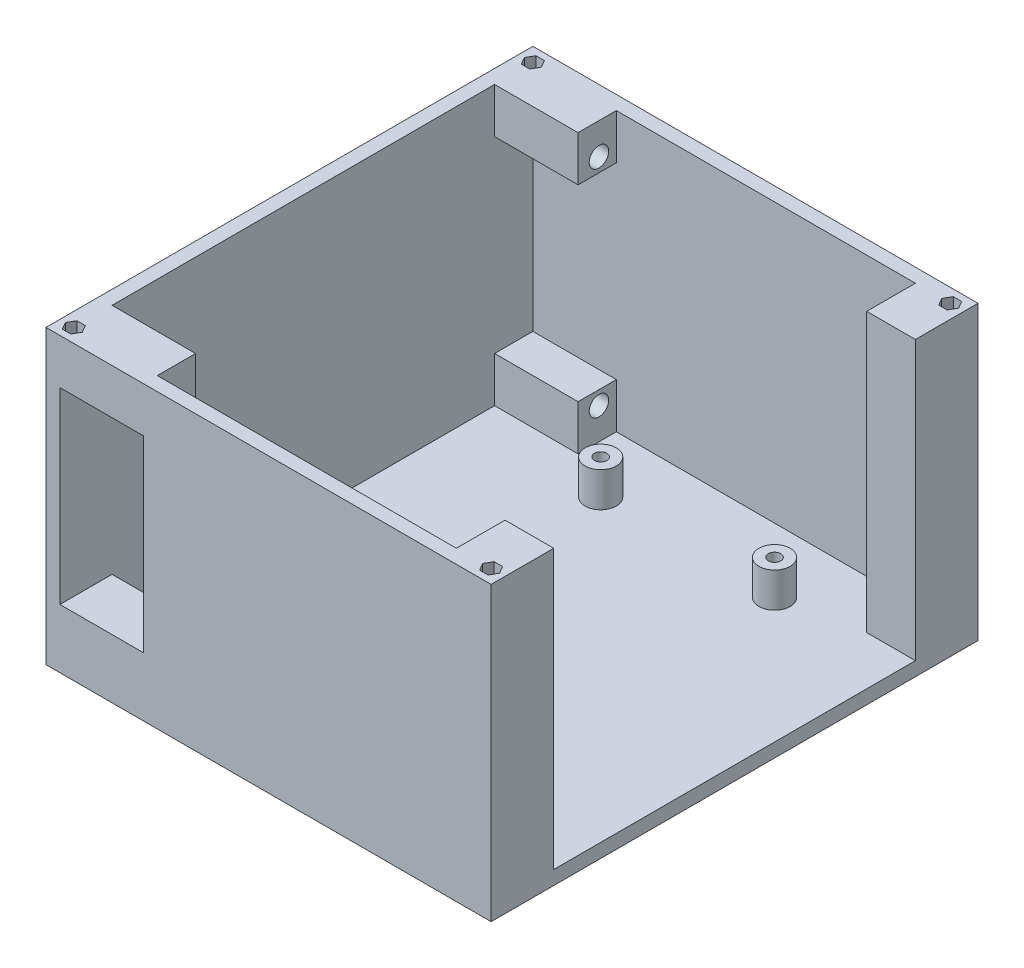
from build123d import *

# Parameters (mm, degrees)
SKETCH1_W           = 64
SKETCH1_H           = 70
BOSS_EXTRUDE1_DEPTH = 2
SKETCH2_W           = 64
SKETCH2_H           = 70
BOSS_EXTRUDE2_DEPTH = 40
SKETCH3_R           = 2.25
SKETCH3_R_2         = 0.9
BOSS_EXTRUDE3_DEPTH = 5
SKETCH4_W           = 52
SKETCH4_H           = 40
CUT_EXTRUDE1_DEPTH  = 2
SKETCH5_R           = 1
CUT_EXTRUDE4_DEPTH  = 4
CUT_EXTRUDE5_DEPTH  = 2.3
SKETCH7_R           = 1.4
CUT_EXTRUDE6_DEPTH  = 12
CUT_EXTRUDE7_REACH  = 105.73
SKETCH8_W           = 12
SKETCH8_H           = 27


with BuildPart() as part:
    # Sketch1 → Boss-Extrude1 (new body)
    with BuildSketch(Plane(origin=(0, 0, 0), x_dir=(1, 0, 0), z_dir=(0, 1, 0))):
        with Locations((32, -35)):
            Rectangle(SKETCH1_W, SKETCH1_H)
    extrude(amount=BOSS_EXTRUDE1_DEPTH)

    # Sketch2 → Boss-Extrude2 (add)
    with BuildSketch(Plane(origin=(0, 2, 0), x_dir=(1, 0, 0), z_dir=(0, 1, 0))):
        with Locations((32, -35)):
            Rectangle(SKETCH2_W, SKETCH2_H)
        Polygon((14, -2), (57, -2), (57, -9), (62, -9), (62, -61), (57, -61), (57, -68), (14, -68), (14, -62.5), (2, -62.5), (2, -7.5), (14, -7.5), align=None, mode=Mode.SUBTRACT)
    extrude(amount=BOSS_EXTRUDE2_DEPTH)

    # Sketch3 → Boss-Extrude3 (add)
    # profile 1 of 4: a face of its own
    with BuildSketch(Plane(origin=(0, 2, 0), x_dir=(1, 0, 0), z_dir=(0, 1, 0))):
        with Locations(Location((21, -58.75, 0), (0, 0, 270))):
            Circle(SKETCH3_R)
        with Locations(Location((21, -58.75, 0), (0, 0, 270))):
            Circle(SKETCH3_R_2, mode=Mode.SUBTRACT)
    # profile 2 of 4: a face of its own
    with BuildSketch(Plane(origin=(0, 2, 0), x_dir=(1, 0, 0), z_dir=(0, 1, 0))):
        with Locations(Location((46, -58.75, 0), (0, 0, 270))):
            Circle(SKETCH3_R)
        with Locations(Location((46, -58.75, 0), (0, 0, 270))):
            Circle(SKETCH3_R_2, mode=Mode.SUBTRACT)
    # profile 3 of 4: a face of its own
    with BuildSketch(Plane(origin=(0, 2, 0), x_dir=(1, 0, 0), z_dir=(0, 1, 0))):
        with Locations(Location((21, -11.25, 0), (0, 0, 270))):
            Circle(SKETCH3_R)
        with Locations(Location((21, -11.25, 0), (0, 0, 270))):
            Circle(SKETCH3_R_2, mode=Mode.SUBTRACT)
    # profile 4 of 4: a face of its own
    with BuildSketch(Plane(origin=(0, 2, 0), x_dir=(1, 0, 0), z_dir=(0, 1, 0))):
        with Locations(Location((46, -11.25, 0), (0, 0, 270))):
            Circle(SKETCH3_R)
        with Locations(Location((46, -11.25, 0), (0, 0, 270))):
            Circle(SKETCH3_R_2, mode=Mode.SUBTRACT)
    extrude(amount=BOSS_EXTRUDE3_DEPTH)

    # Sketch4 → Cut-Extrude1 (cut)
    with BuildSketch(Plane(origin=(64, 0, 0), x_dir=(0, 0, -1), z_dir=(1, 0, 0))):
        with Locations((-35, 22)):
            Rectangle(SKETCH4_W, SKETCH4_H)
    extrude(amount=-CUT_EXTRUDE1_DEPTH, mode=Mode.SUBTRACT)

    # Sketch5 → Cut-Extrude4 (cut)
    with BuildSketch(Plane.ZY.offset(-57)):
        with Locations((7, 40)):
            Circle(SKETCH5_R)
        with Locations((7, 4)):
            Circle(SKETCH5_R)
        with Locations((63, 4)):
            Circle(SKETCH5_R)
        with Locations((63, 40)):
            Circle(SKETCH5_R)
    extrude(amount=-CUT_EXTRUDE4_DEPTH, mode=Mode.SUBTRACT)

    # Sketch6 → Cut-Extrude5 (cut)
    with BuildSketch(Plane(origin=(0, 42, 0), x_dir=(1, 0, 0), z_dir=(0, 1, 0))):
        Polygon((3.212435565, -2), (2.606217783, -0.95), (1.393782217, -0.95), (0.787564435, -2), (1.393782217, -3.05), (2.606217783, -3.05), align=None)
        Polygon((3.212435565, -68), (2.606217783, -66.95), (1.393782217, -66.95), (0.787564435, -68), (1.393782217, -69.05), (2.606217783, -69.05), align=None)
        Polygon((60.787564435, -68), (61.393782217, -69.05), (62.606217783, -69.05), (63.212435565, -68), (62.606217783, -66.95), (61.393782217, -66.95), align=None)
        Polygon((60.787564435, -2), (61.393782217, -3.05), (62.606217783, -3.05), (63.212435565, -2), (62.606217783, -0.95), (61.393782217, -0.95), align=None)
    extrude(amount=-CUT_EXTRUDE5_DEPTH, mode=Mode.SUBTRACT)

    # Sketch7 → Cut-Extrude6 (cut)
    with BuildSketch(Plane(origin=(14, 0, 0), x_dir=(0, 0, -1), z_dir=(1, 0, 0))):
        with Locations((-65.5, 37.5)):
            Circle(SKETCH7_R)
        with Locations((-4.5, 37.5)):
            Circle(SKETCH7_R)
        with Locations((-65.5, 6.5)):
            Circle(SKETCH7_R)
        with Locations((-4.5, 6.5)):
            Circle(SKETCH7_R)
    extrude(amount=-CUT_EXTRUDE6_DEPTH, mode=Mode.SUBTRACT)

    # Cut-Extrude7: up to this face of the body (flat: up to its plane)
    cut_extrude7_end = Plane(part.part.faces().sort_by_distance((35.5, 22, 2))[0])
    # Sketch8 → Cut-Extrude7 (cut, up to the picked face)
    with BuildSketch(Plane.XY.offset(70), mode=Mode.PRIVATE) as cut_extrude7_sk1:
        with Locations((8, 22)):
            Rectangle(SKETCH8_W, SKETCH8_H)
    cut_extrude7_tool1 = split(extrude(cut_extrude7_sk1.sketch, amount=-CUT_EXTRUDE7_REACH, mode=Mode.PRIVATE), bisect_by=cut_extrude7_end, keep=Keep.BOTH, mode=Mode.PRIVATE)
    add(cut_extrude7_tool1.solids().sort_by(Axis((8, 22, 70), (0, 0, -1)))[0], mode=Mode.SUBTRACT)


solid = part.part
